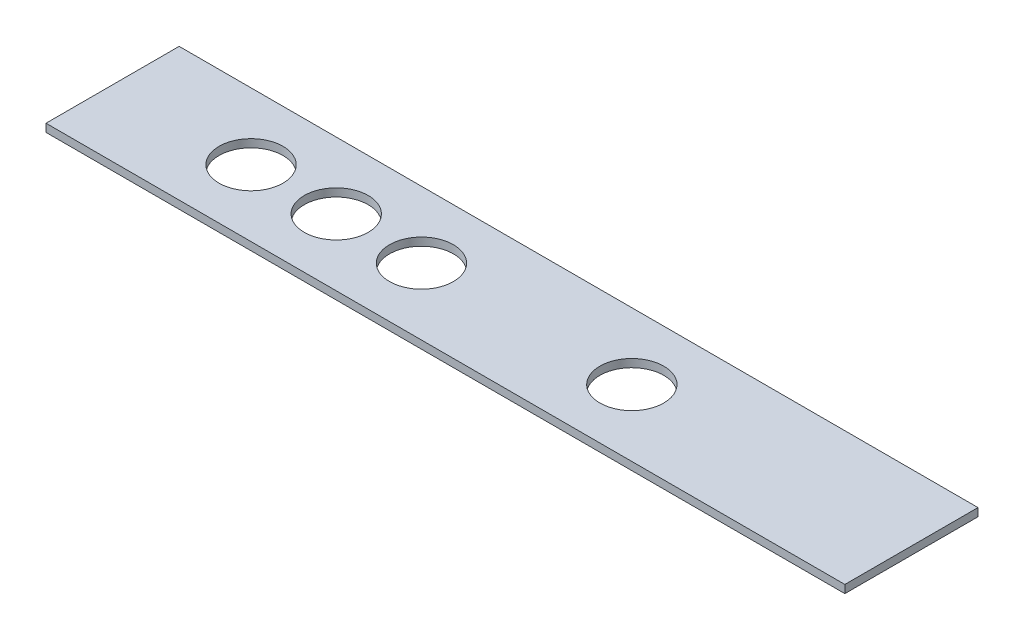
from build123d import *

# Parameters (mm, degrees)
SKETCH1_W           = 300
SKETCH1_H           = 50
SKETCH1_R           = 12
BOSS_EXTRUDE1_DEPTH = 3


with BuildPart() as part:
    # Sketch1 → Boss-Extrude1 (new body)
    with BuildSketch(Plane(origin=(0, 0, 0), x_dir=(1, 0, 0), z_dir=(0, 1, 0))):
        with Locations((1.361867704, 28.112840467)):
            Rectangle(SKETCH1_W, SKETCH1_H)
        with Locations(Location((-96.638132296, 28.112840467, 0), (0, 0, 270))):
            Circle(SKETCH1_R, mode=Mode.SUBTRACT)
        with Locations(Location((-64.638132296, 28.112840467, 0), (0, 0, 270))):
            Circle(SKETCH1_R, mode=Mode.SUBTRACT)
        with Locations(Location((-32.638132296, 28.112840467, 0), (0, 0, 270))):
            Circle(SKETCH1_R, mode=Mode.SUBTRACT)
        with Locations(Location((46.361867704, 28.112840467, 0), (0, 0, 270))):
            Circle(SKETCH1_R, mode=Mode.SUBTRACT)
    extrude(amount=BOSS_EXTRUDE1_DEPTH)


solid = part.part
